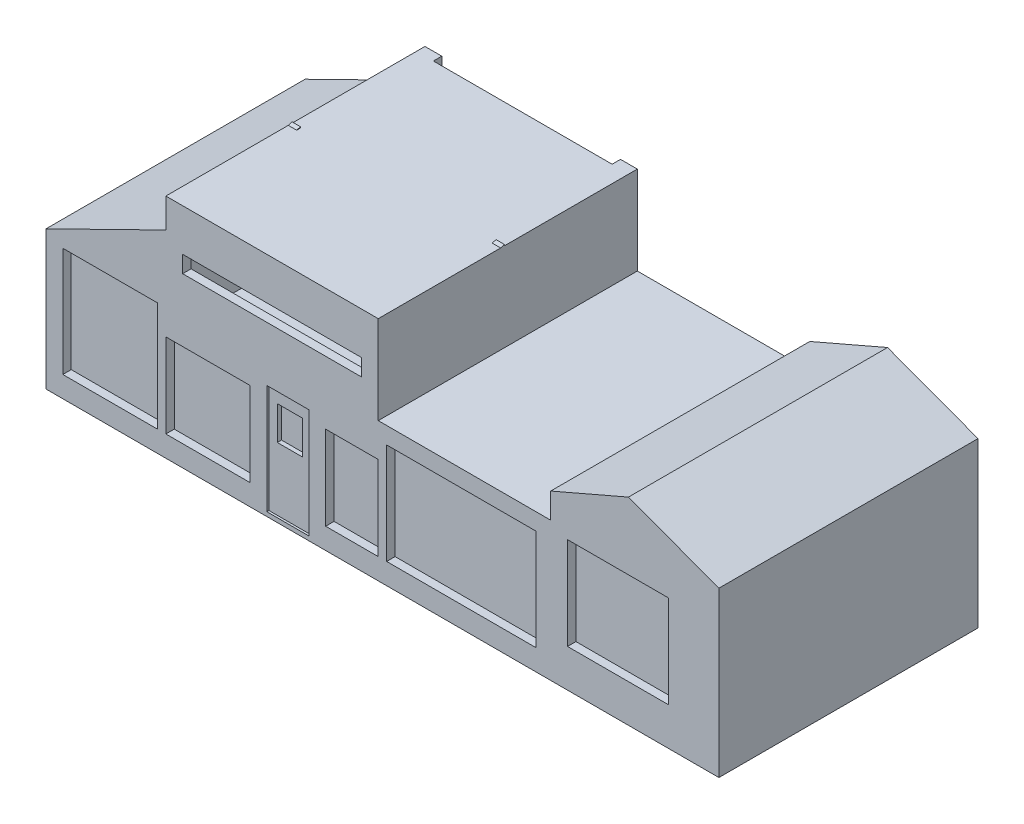
from build123d import *

# Parameters (mm, degrees)
SKETCH1_W            = 1016
SKETCH1_H            = 342.9
BOSS_EXTRUDE1_DEPTH  = 391.2
CUT_EXTRUDE1_DEPTH   = 1142.434995959
FRONT_W              = 142.875
FRONT_H              = 165.1
FRONT_W_2            = 79.375
FRONT_H_2            = 127
FRONT_W_3            = 63.5
FRONT_W_4            = 127
FRONT_W_5            = 269.875
FRONT_H_3            = 25.4
FRONT_W_6            = 152.4
FRONT_H_4            = 139.7
FRONT_W_7            = 225.425
FRONT_H_5            = 152.4
CUT_EXTRUDE4_DEPTH   = 12.7
RIGHT_W              = 152.4
RIGHT_H              = 101.6
CUT_EXTRUDE5_DEPTH   = 12.7
BACK_3_W             = 269.875
BACK_3_H             = 38.1
BACK_3_W_2           = 152.4
BACK_3_H_2           = 139.7
BACK_3_W_3           = 165.1
BACK_3_H_3           = 63.5
BACK_3_H_4           = 50.8
BACK_3_W_4           = 63.5
BACK_3_H_5           = 25.4
CUT_EXTRUDE6_DEPTH   = 12.7
CUT_EXTRUDE12_START  = 76.2
SKETCH19_W           = 50.8
SKETCH19_H           = 31.75
SKETCH19_H_2         = 50.8
SKETCH19_W_2         = 165.1
SKETCH19_H_3         = 127
SKETCH19_W_3         = 66.675
SKETCH19_H_4         = 57.15
CUT_EXTRUDE12_DEPTH  = 101.6
TOP_ROOM_DEPTH       = 177.8
TOPSAIDE_DEPTH       = 12.7
TOPSIDE_DEPTH        = 12.7
SKETCH42_W           = 50.8
SKETCH42_H           = 31.75
TABLE_DEPTH          = 50.8
CUT_EXTRUDE35_START  = 88.9
SKETCH31_W           = 50.8
SKETCH31_H           = 31.75
SKETCH31_H_2         = 50.8
SKETCH31_W_2         = 66.675
SKETCH31_H_3         = 57.15
CUT_EXTRUDE35_DEPTH  = 88.9
SKETCH31_7_W         = 76.2
SKETCH31_7_H         = 50.8
CUT_EXTRUDE36_DEPTH  = 114.3
BOSS_EXTRUDE30_START = -6.35
SKETCH76_W           = 63.5
SKETCH76_H           = 165.1
SKETCH76_W_2         = 38.1
SKETCH76_H_2         = 50.8
BOSS_EXTRUDE30_DEPTH = 3.175
SCALE7_SCALE         = 0.25
SCALE8_SCALE         = 0.8
SCALE9_SCALE         = 1.1


with BuildPart() as part:
    # Sketch1 → Boss-Extrude1 (new body)
    with BuildSketch(Plane.XY):
        with Locations((508, 171.45)):
            Rectangle(SKETCH1_W, SKETCH1_H)
    extrude(amount=-BOSS_EXTRUDE1_DEPTH)

    # Back → Cut-Extrude1 (cut, through all)
    with BuildSketch(Plane(origin=(0, 0, -391.2), x_dir=(-1, 0, 0), z_dir=(0, 0, -1))):
        Polygon((0, 342.9), (-180.975, 342.9), (-180.975, 298.45), (0, 209.55), align=None)
        Polygon((-501.65, 209.55), (-501.65, 342.9), (-1016, 342.9), (-1016, 247.65), (-879.414234058, 298.45), (-762, 247.65), (-762, 209.55), align=None)
    extrude(amount=-CUT_EXTRUDE1_DEPTH, mode=Mode.SUBTRACT)

    # Front → Cut-Extrude4 (cut)
    with BuildSketch(Plane.XY):
        with Locations((96.8375, 114.3)):
            Rectangle(FRONT_W, FRONT_H)
        with Locations((461.9625, 95.25)):
            Rectangle(FRONT_W_2, FRONT_H_2)
        with Locations((365.125, 88.9)):
            Rectangle(FRONT_W_3, FRONT_H)
        with Locations((244.475, 95.25)):
            Rectangle(FRONT_W_4, FRONT_H_2)
        with Locations((341.3125, 266.7)):
            Rectangle(FRONT_W_5, FRONT_H_3)
        with Locations((863.6, 127)):
            Rectangle(FRONT_W_6, FRONT_H_4)
        with Locations((627.0625, 107.95)):
            Rectangle(FRONT_W_7, FRONT_H_5)
    extrude(amount=-CUT_EXTRUDE4_DEPTH, mode=Mode.SUBTRACT)

    # Right → Cut-Extrude5 (cut)
    with BuildSketch(Plane.ZY):
        with Locations((-101.6, 133.35)):
            Rectangle(RIGHT_W, RIGHT_H)
    extrude(amount=-CUT_EXTRUDE5_DEPTH, mode=Mode.SUBTRACT)

    # Back<3> → Cut-Extrude6 (cut)
    with BuildSketch(Plane(origin=(0, 0, -391.2), x_dir=(-1, 0, 0), z_dir=(0, 0, -1))):
        with Locations((-341.3125, 323.85)):
            Rectangle(BACK_3_W, BACK_3_H)
        with Locations((-863.6, 127)):
            Rectangle(BACK_3_W_2, BACK_3_H_2)
        with Locations((-396.875, 127)):
            Rectangle(BACK_3_W_3, BACK_3_H_3)
        with Locations((-341.3125, 266.7)):
            Rectangle(BACK_3_W, BACK_3_H_4)
        with Locations((-558.8, 171.45)):
            Rectangle(BACK_3_W_4, BACK_3_H_5)
    extrude(amount=-CUT_EXTRUDE6_DEPTH, mode=Mode.SUBTRACT)

    # Sketch19 → Cut-Extrude12 (cut)
    with BuildSketch(Plane(origin=(0, 6.35, 0), x_dir=(1, 0, 0), z_dir=(0, 1, 0)).offset(CUT_EXTRUDE12_START)):
        with Locations((107.95, 98.425)):
            Rectangle(SKETCH19_W, SKETCH19_H)
        with BuildLine():
            Line((501.65, 139.7), (518.88982311, 139.7))
            Line((518.88982311, 139.7), (518.88982311, 153.062277318))
            add(Edge.make_bspline(
                [(518.88982311, 153.062277318), (570.23, 126.95898814), (570.23, 165.1), (570.23, 203.24101186), (518.88982311, 177.137722682)],
                knots=[3.958623604, 3.958623604, 3.958623604, 6.283185307, 6.283185307, 8.607747011, 8.607747011, 8.607747011], degree=2, weights=[1, 0.397247401, 1, 0.397247401, 1]))
            Line((518.88982311, 177.137722682), (518.88982311, 190.5))
            Line((518.88982311, 190.5), (501.65, 190.5))
            Line((501.65, 190.5), (501.65, 139.7))
        make_face()
        with BuildLine():
            Line((692.15, 126.365), (692.15, 190.5))
            Line((692.15, 190.5), (627.888, 190.5))
            Line((627.888, 190.5), (627.888, 155.575))
            ThreePointArc((627.888, 155.575), (636.443410922, 134.920410922), (657.098, 126.365))
            Line((657.098, 126.365), (692.15, 126.365))
        make_face()
        with Locations((666.75, 98.425)):
            Rectangle(SKETCH19_W, SKETCH19_H_2)
        with Locations((727.075, 88.9)):
            Rectangle(SKETCH19_W, SKETCH19_H)
        with Locations((882.65, 101.6)):
            Rectangle(SKETCH19_W_2, SKETCH19_H_3)
        with Locations((534.9875, 101.6)):
            Rectangle(SKETCH19_W_3, SKETCH19_H_4)
    extrude(amount=CUT_EXTRUDE12_DEPTH, mode=Mode.SUBTRACT)

    # Sketch36 → top room (cut)
    with BuildSketch(Plane.XY.offset(-12.7)):
        Polygon((488.799405704, 177.8), (488.799405704, 254), (488.95, 254), (488.95, 298.45), (193.675, 298.45), (193.675, 177.8), align=None)
    extrude(amount=-TOP_ROOM_DEPTH, mode=Mode.SUBTRACT)

    # Sketch39 → topsaide (add)
    with BuildSketch(Plane.ZY.offset(-180.975)):
        Polygon((-190.5, 344.6755754), (-190.5, 342.9), (-184.81815872, 342.9), align=None)
    extrude(amount=-TOPSAIDE_DEPTH)

    # Sketch40 → topside (add)
    with BuildSketch(Plane(origin=(501.65, 0, 0), x_dir=(0, 0, -1), z_dir=(1, 0, 0))):
        Polygon((184.81815872, 342.9), (190.5, 342.9), (190.5, 344.6755754), align=None)
    extrude(amount=-TOPSIDE_DEPTH)

    # Sketch42 → table (add)
    with BuildSketch(Plane(origin=(0, 6.35, 0), x_dir=(1, 0, 0), z_dir=(0, 1, 0))):
        with Locations((107.95, 98.425)):
            Rectangle(SKETCH42_W, SKETCH42_H)
    extrude(amount=TABLE_DEPTH)

    # Sketch31 → Cut-Extrude35 (cut)
    with BuildSketch(Plane.XZ.offset(-171.45).offset(CUT_EXTRUDE35_START)):
        with Locations((727.075, -88.9)):
            Rectangle(SKETCH31_W, SKETCH31_H)
        with Locations((666.75, -98.425)):
            Rectangle(SKETCH31_W, SKETCH31_H_2)
        with BuildLine():
            Line((692.15, -190.5), (692.15, -126.365))
            Line((692.15, -126.365), (657.098, -126.365))
            ThreePointArc((657.098, -126.365), (636.443410922, -134.920410922), (627.888, -155.575))
            Line((627.888, -155.575), (627.888, -190.5))
            Line((627.888, -190.5), (692.15, -190.5))
        make_face()
        with BuildLine():
            Line((501.65, -190.5), (518.88982311, -190.5))
            Line((518.88982311, -190.5), (518.88982311, -177.137722682))
            add(Edge.make_bspline(
                [(518.88982311, -177.137722682), (570.23, -203.24101186), (570.23, -165.1), (570.23, -126.95898814), (518.88982311, -153.062277318)],
                knots=[3.958623604, 3.958623604, 3.958623604, 6.283185307, 6.283185307, 8.607747011, 8.607747011, 8.607747011], degree=2, weights=[1, 0.397247401, 1, 0.397247401, 1]))
            Line((518.88982311, -153.062277318), (518.88982311, -139.7))
            Line((518.88982311, -139.7), (501.65, -139.7))
            Line((501.65, -139.7), (501.65, -190.5))
        make_face()
        with BuildLine():
            Line((244.475, -88.9), (244.475, -139.7))
            Line((244.475, -139.7), (295.275, -139.7))
            Line((295.275, -139.7), (295.275, -88.9))
            ThreePointArc((295.275, -88.9), (269.875, -63.5), (244.475, -88.9))
        make_face()
        with Locations((534.9875, -101.6)):
            Rectangle(SKETCH31_W_2, SKETCH31_H_3)
    extrude(amount=-CUT_EXTRUDE35_DEPTH, mode=Mode.SUBTRACT)

    # Sketch31<7> → Cut-Extrude36 (cut)
    with BuildSketch(Plane.XZ.offset(-171.45)):
        with Locations((539.75, -165.1)):
            Rectangle(SKETCH31_7_W, SKETCH31_7_H)
    extrude(amount=CUT_EXTRUDE36_DEPTH, mode=Mode.SUBTRACT)


with BuildPart() as body_2:
    # Sketch76 → Boss-Extrude30 (new, symmetric)
    with BuildSketch(Plane.XY.offset(BOSS_EXTRUDE30_START)):
        with Locations((365.125, 88.9)):
            Rectangle(SKETCH76_W, SKETCH76_H)
        with Locations((365.125, 127)):
            Rectangle(SKETCH76_W_2, SKETCH76_H_2, mode=Mode.SUBTRACT)
    extrude(amount=BOSS_EXTRUDE30_DEPTH, both=True)


with BuildPart() as body_2_1:
    # Scale7: scaled about (0, 0, 0)
    add(body_2.part.scale(SCALE7_SCALE))


with BuildPart() as part_1:
    # Scale7: scaled about (0, 0, 0)
    add(part.part.scale(SCALE7_SCALE))


with BuildPart() as part_2:
    # Scale8: scaled about (0, 0, 0)
    add(part_1.part.scale(SCALE8_SCALE))


with BuildPart() as body_2_2:
    # Scale8: scaled about (0, 0, 0)
    add(body_2_1.part.scale(SCALE8_SCALE))


with BuildPart() as part_3:
    # Scale9: scaled about (0, 0, 0)
    add(part_2.part.scale(SCALE9_SCALE))


with BuildPart() as body_2_3:
    # Scale9: scaled about (0, 0, 0)
    add(body_2_2.part.scale(SCALE9_SCALE))


solid = Compound([part_3.part, body_2_3.part])
